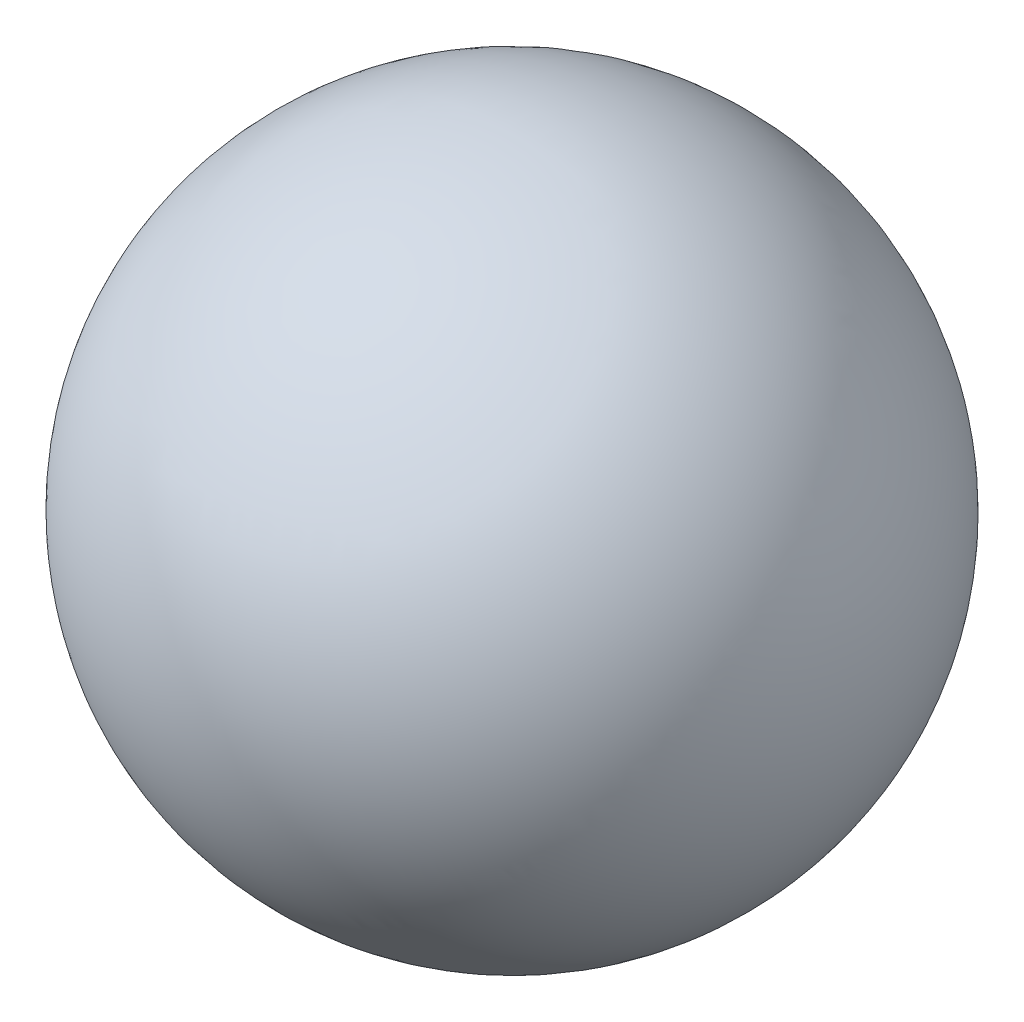
from build123d import *


with BuildPart() as part:
    # Sketch5 → Revolve1 (revolve)
    with BuildSketch(Plane.XY):
        with BuildLine():
            Line((-197.089473573, -19.197171869), (-187.266928324, -17.190591842))
            ThreePointArc((-187.266928324, -17.190591842), (-193.169885134, -13.339421699), (-197.089473573, -19.197171869))
        make_face()
    revolve(axis=Axis((-197.089473573, -19.197171869, 0), (0.9797653666970677, 0.2001495096695483, 0)))


solid = part.part
